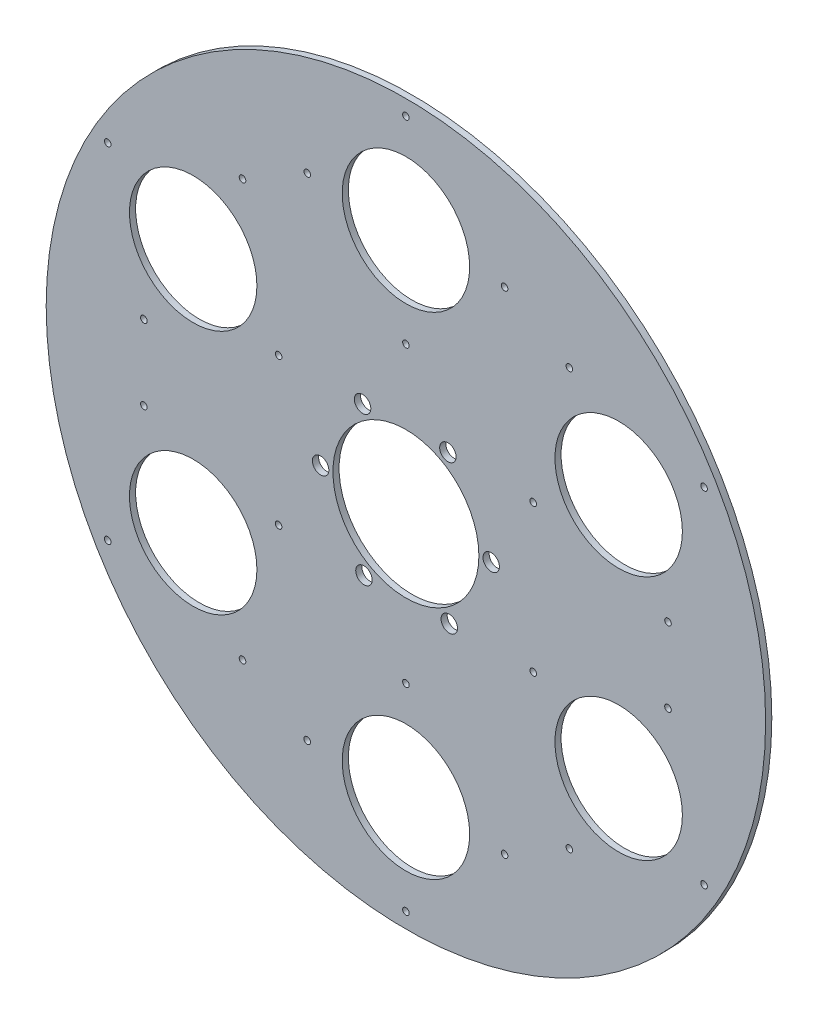
from build123d import *

# Parameters (mm, degrees)
SKETCH1_R           = 175
SKETCH1_R_2         = 35.5
SKETCH1_R_3         = 31
BOSS_EXTRUDE1_DEPTH = 3
SKETCH2_R           = 1.6
CUT_EXTRUDE1_DEPTH  = 3
SKETCH3_R           = 4
CUT_EXTRUDE2_DEPTH  = 3


with BuildPart() as part:
    # Sketch1 → Boss-Extrude1 (new body)
    with BuildSketch(Plane.XY):
        Circle(SKETCH1_R)
        Circle(SKETCH1_R_2, mode=Mode.SUBTRACT)
        with Locations((0, 119.5)):
            Circle(SKETCH1_R_3, mode=Mode.SUBTRACT)
        with Locations((103.490035752, 59.75)):
            Circle(SKETCH1_R_3, mode=Mode.SUBTRACT)
        with Locations((103.490035752, -59.75)):
            Circle(SKETCH1_R_3, mode=Mode.SUBTRACT)
        with Locations((0, -119.5)):
            Circle(SKETCH1_R_3, mode=Mode.SUBTRACT)
        with Locations((-103.490035752, -59.75)):
            Circle(SKETCH1_R_3, mode=Mode.SUBTRACT)
        with Locations((-103.490035752, 59.75)):
            Circle(SKETCH1_R_3, mode=Mode.SUBTRACT)
    extrude(amount=-BOSS_EXTRUDE1_DEPTH)

    # Sketch2 → Cut-Extrude1 (cut)
    with BuildSketch(Plane.XY):
        with Locations((0, 71.5)):
            Circle(SKETCH2_R)
        with Locations((-48, 119.5)):
            Circle(SKETCH2_R)
        with Locations((0, 167.5)):
            Circle(SKETCH2_R)
        with Locations((48, 119.5)):
            Circle(SKETCH2_R)
        with Locations((61.920816371, 35.75)):
            Circle(SKETCH2_R)
        with Locations((79.490035752, 101.319219382)):
            Circle(SKETCH2_R)
        with Locations((145.059255134, 83.75)):
            Circle(SKETCH2_R)
        with Locations((127.490035752, 18.180780618)):
            Circle(SKETCH2_R)
        with Locations((61.920816371, -35.75)):
            Circle(SKETCH2_R)
        with Locations((127.490035752, -18.180780618)):
            Circle(SKETCH2_R)
        with Locations((145.059255134, -83.75)):
            Circle(SKETCH2_R)
        with Locations((79.490035752, -101.319219382)):
            Circle(SKETCH2_R)
        with Locations((0, -71.5)):
            Circle(SKETCH2_R)
        with Locations((48, -119.5)):
            Circle(SKETCH2_R)
        with Locations((0, -167.5)):
            Circle(SKETCH2_R)
        with Locations((-48, -119.5)):
            Circle(SKETCH2_R)
        with Locations((-61.920816371, -35.75)):
            Circle(SKETCH2_R)
        with Locations((-79.490035752, -101.319219382)):
            Circle(SKETCH2_R)
        with Locations((-145.059255134, -83.75)):
            Circle(SKETCH2_R)
        with Locations((-127.490035752, -18.180780618)):
            Circle(SKETCH2_R)
        with Locations((-61.920816371, 35.75)):
            Circle(SKETCH2_R)
        with Locations((-127.490035752, 18.180780618)):
            Circle(SKETCH2_R)
        with Locations((-145.059255134, 83.75)):
            Circle(SKETCH2_R)
        with Locations((-79.490035752, 101.319219382)):
            Circle(SKETCH2_R)
    extrude(amount=-CUT_EXTRUDE1_DEPTH, mode=Mode.SUBTRACT)

    # Sketch3 → Cut-Extrude2 (cut)
    with BuildSketch(Plane.XY):
        with Locations((-21.081787365, 35.74644376)):
            Circle(SKETCH3_R)
        with Locations((20.416434709, 36.130585295)):
            Circle(SKETCH3_R)
        with Locations((41.498222074, 0.384141535)):
            Circle(SKETCH3_R)
        with Locations((-41.498222074, -0.384141535)):
            Circle(SKETCH3_R)
        with Locations((-20.416434709, -36.130585295)):
            Circle(SKETCH3_R)
        with Locations((21.081787365, -35.74644376)):
            Circle(SKETCH3_R)
    extrude(amount=-CUT_EXTRUDE2_DEPTH, mode=Mode.SUBTRACT)


solid = part.part
